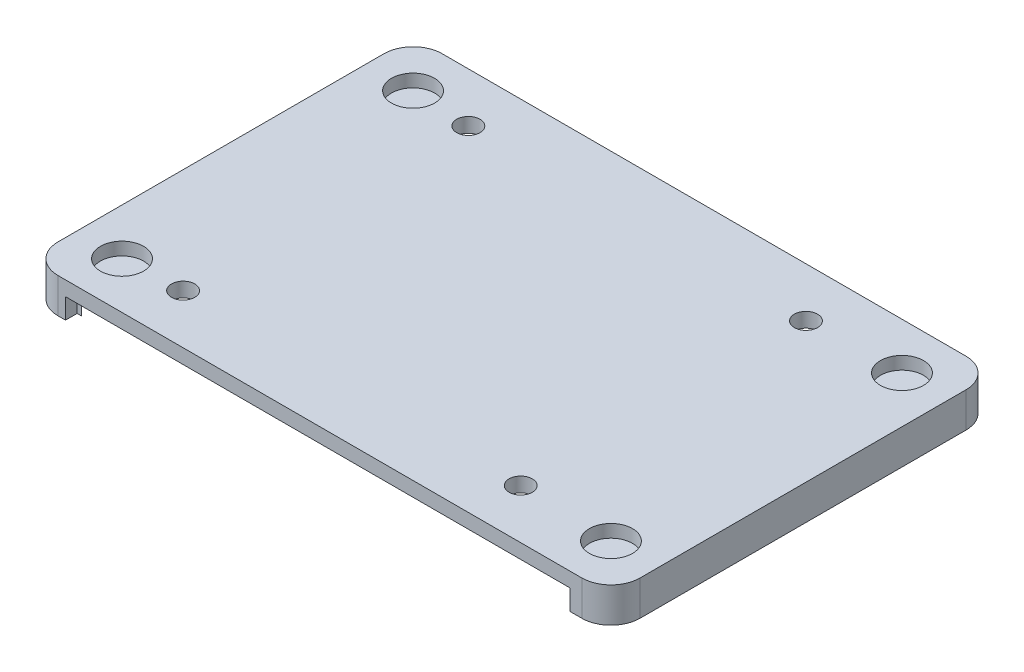
from build123d import *

# Parameters (mm, degrees)
BOSS_EXTRUDE2_DEPTH = 6
CUT_EXTRUDE1_DEPTH  = 3.5
SKETCH5_R           = 3.7
CUT_EXTRUDE2_DEPTH  = 2.2
SKETCH6_R           = 2
CUT_EXTRUDE3_DEPTH  = 120.966662036
SKETCH11_W          = 2.417424305
SKETCH11_H          = 56
SKETCH11_W_2        = 86.709228263
SKETCH11_H_2        = 2
CUT_EXTRUDE7_DEPTH  = 3.5


with BuildPart() as part:
    # Sketch1 → Boss-Extrude2 (new body)
    with BuildSketch(Plane(origin=(0, 0, 0), x_dir=(1, 0, 0), z_dir=(0, 1, 0))):
        with BuildLine():
            Line((5, 0), (95, 0))
            ThreePointArc((95, 0), (98.535533906, 1.464466094), (100, 5))
            Line((100, 5), (100, 61))
            ThreePointArc((100, 61), (98.535533906, 64.535533906), (95, 66))
            Line((95, 66), (5, 66))
            ThreePointArc((5, 66), (1.464466094, 64.535533906), (0, 61))
            Line((0, 61), (0, 5))
            ThreePointArc((0, 5), (1.464466094, 1.464466094), (5, 0))
        make_face()
    extrude(amount=BOSS_EXTRUDE2_DEPTH)

    # Sketch2 → Cut-Extrude1 (cut)
    with BuildSketch(Plane.XZ):
        with BuildLine():
            Line((7, -2), (93, -2))
            ThreePointArc((93, -2), (96.535533906, -3.464466094), (98, -7))
            Line((98, -7), (98, -59))
            ThreePointArc((98, -59), (96.535533906, -62.535533906), (93, -64))
            Line((93, -64), (7, -64))
            ThreePointArc((7, -64), (3.464466094, -62.535533906), (2, -59))
            Line((2, -59), (2, -7))
            ThreePointArc((2, -7), (3.464466094, -3.464466094), (7, -2))
        make_face()
    extrude(amount=-CUT_EXTRUDE1_DEPTH, mode=Mode.SUBTRACT)

    # Sketch5 → Cut-Extrude2 (cut)
    with BuildSketch(Plane(origin=(0, 6, 0), x_dir=(1, 0, 0), z_dir=(0, 1, 0))):
        with Locations(Location((8, 58, 0), (0, 0, 270))):
            Circle(SKETCH5_R)
        with Locations(Location((8, 8, 0), (0, 0, 270))):
            Circle(SKETCH5_R)
        with Locations(Location((92, 58, 0), (0, 0, 270))):
            Circle(SKETCH5_R)
        with Locations(Location((92, 8, 0), (0, 0, 270))):
            Circle(SKETCH5_R)
    extrude(amount=-CUT_EXTRUDE2_DEPTH, mode=Mode.SUBTRACT)

    # Sketch6 → Cut-Extrude3 (cut, through all)
    with BuildSketch(Plane(origin=(0, 6, 0), x_dir=(1, 0, 0), z_dir=(0, 1, 0))):
        with Locations(Location((18, 57.5, 0), (0, 0, 270))):
            Circle(SKETCH6_R)
        with Locations(Location((18, 8.5, 0), (0, 0, 270))):
            Circle(SKETCH6_R)
        with Locations(Location((76, 57.5, 0), (0, 0, 270))):
            Circle(SKETCH6_R)
        with Locations(Location((76, 8.5, 0), (0, 0, 270))):
            Circle(SKETCH6_R)
    extrude(amount=-CUT_EXTRUDE3_DEPTH, mode=Mode.SUBTRACT)

    # Sketch11 → Cut-Extrude7 (cut)
    with BuildSketch(Plane(origin=(0, 0, 0), x_dir=(-1, 0, 0), z_dir=(0, -1, 0))):
        with Locations((-1.208712152, 33)):
            Rectangle(SKETCH11_W, SKETCH11_H)
        with Locations((-49.645385869, 1)):
            Rectangle(SKETCH11_W_2, SKETCH11_H_2)
    extrude(amount=-CUT_EXTRUDE7_DEPTH, mode=Mode.SUBTRACT)


solid = part.part
